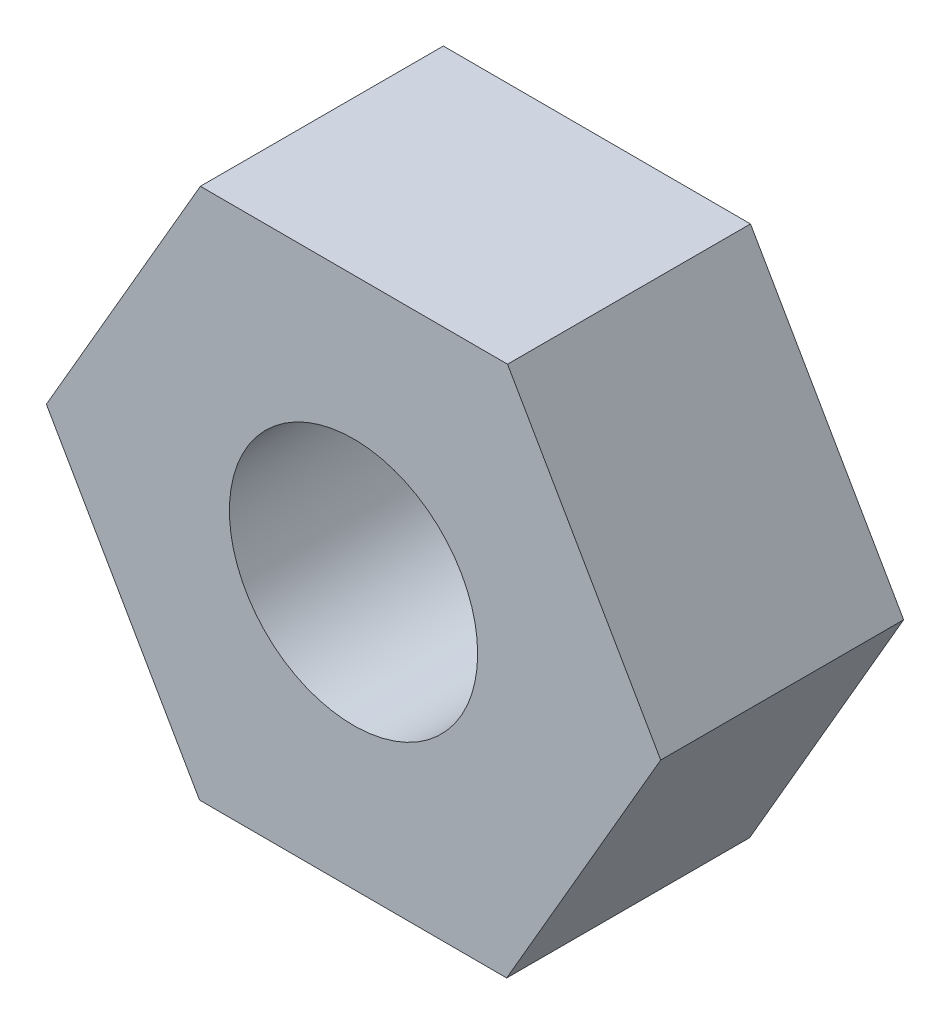
from build123d import *

# Parameters (mm, degrees)
BOSS_EXTRUDE1_DEPTH = 3.4798
SKETCH2_R           = 1.778
CUT_EXTRUDE1_DEPTH  = 3.4798


with BuildPart() as part:
    # Sketch1 → Boss-Extrude1 (new body)
    with BuildSketch(Plane.XY):
        Polygon((-2.193446664, 3.813606132), (-4.399403123, 0.007222533), (-2.205956458, -3.806383599), (2.193446664, -3.813606132), (4.399403123, -0.007222533), (2.205956458, 3.806383599), align=None)
    extrude(amount=BOSS_EXTRUDE1_DEPTH)

    # Sketch2 → Cut-Extrude1 (cut)
    with BuildSketch(Plane.XY.offset(3.4798)):
        Circle(SKETCH2_R)
    extrude(amount=-CUT_EXTRUDE1_DEPTH, mode=Mode.SUBTRACT)


solid = part.part
